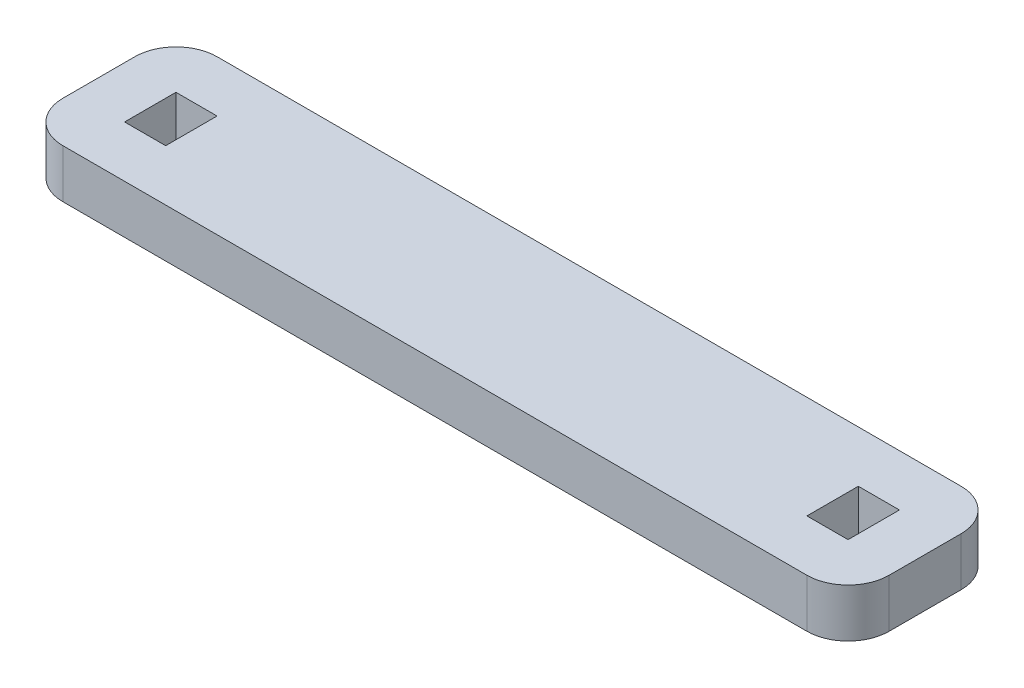
from build123d import *

# Parameters (mm, degrees)
SKETCH1_W           = 51.054
SKETCH1_H           = 9.525
SKETCH1_W_2         = 2.54
SKETCH1_H_2         = 3.175
BOSS_EXTRUDE1_DEPTH = 1.5
FILLET1_R           = 2.54


with BuildPart() as part:
    # Sketch1 → Boss-Extrude1 (new, symmetric)
    with BuildSketch(Plane(origin=(0, 0, 0), x_dir=(1, 0, 0), z_dir=(0, 1, 0))):
        Rectangle(SKETCH1_W, SKETCH1_H)
        with Locations((-21.082, 0)):
            Rectangle(SKETCH1_W_2, SKETCH1_H_2, mode=Mode.SUBTRACT)
        with Locations((21.082, 0)):
            Rectangle(SKETCH1_W_2, SKETCH1_H_2, mode=Mode.SUBTRACT)
    extrude(amount=BOSS_EXTRUDE1_DEPTH, both=True)

    # Fillet1
    fillet1_edges = [part.edges().sort_by_distance(p)[0] for p in [
        (-25.527, 0, -4.7625),
        (25.527, 0, -4.7625),
        (25.527, 0, 4.7625),
        (-25.527, 0, 4.7625),
    ]]
    fillet(fillet1_edges, radius=FILLET1_R)


solid = part.part
